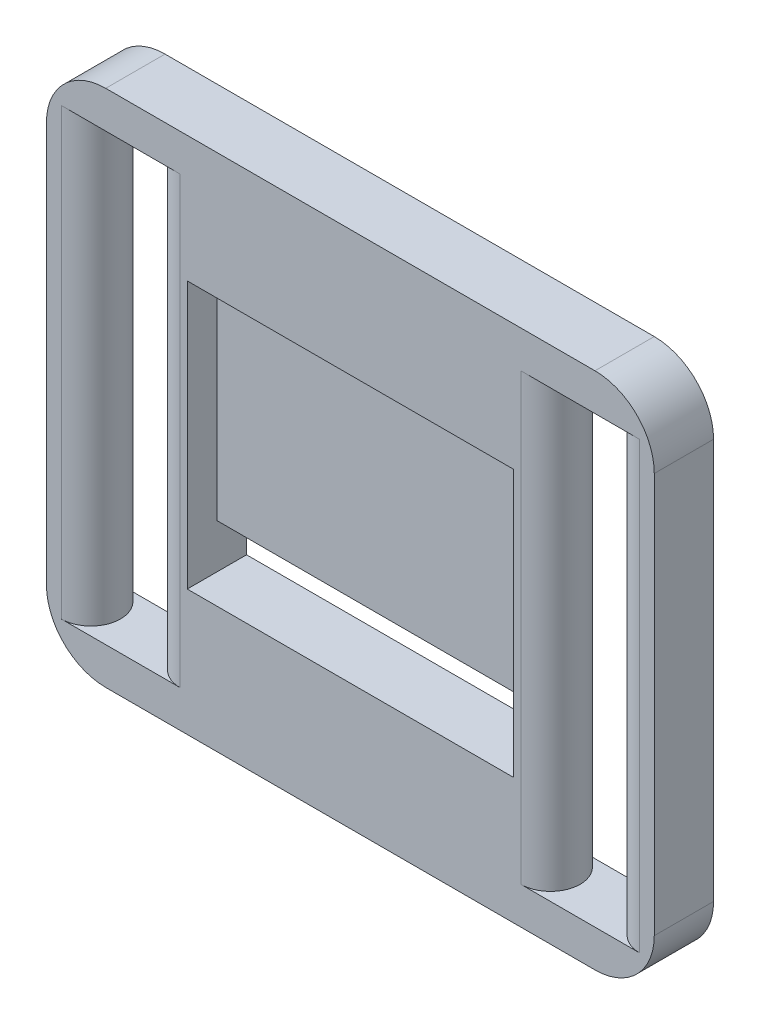
from build123d import *

# Parameters (mm, degrees)
ESQUISSE1_W             = 41
ESQUISSE1_H             = 35
BOSS_EXTRU_1_DEPTH      = 4
ESQUISSE2_W             = 22
ESQUISSE2_H             = 18
ENL_V_MAT_EXTRU_1_DEPTH = 2
ESQUISSE3_W             = 4
ESQUISSE3_H             = 30
ESQUISSE3_W_2           = 22
ESQUISSE3_H_2           = 3
ENL_V_MAT_EXTRU_2_DEPTH = 6
CONG_4_R                = 4
CONG_6_RADIUS           = 2
CONG_6_LENGTH           = 30
CONG_7_RADIUS           = 2
CONG_7_LENGTH           = 30
CONG_8_RADIUS           = 2
CONG_8_LENGTH           = 30
CONG_9_RADIUS           = 2
CONG_9_LENGTH           = 30


with BuildPart() as part:
    # Esquisse1 → Boss.-Extru.1 (new body)
    with BuildSketch(Plane.XY):
        with Locations((20.5, 17.5)):
            Rectangle(ESQUISSE1_W, ESQUISSE1_H)
    extrude(amount=BOSS_EXTRU_1_DEPTH)

    # Esquisse2 → Enlèv. mat.-Extru.1 (cut)
    with BuildSketch(Plane.XY.offset(4)):
        with Locations((20.5, 17.5)):
            Rectangle(ESQUISSE2_W, ESQUISSE2_H)
    extrude(amount=-ENL_V_MAT_EXTRU_1_DEPTH, mode=Mode.SUBTRACT)

    # Esquisse3 → Enlèv. mat.-Extru.2 (cut)
    with BuildSketch(Plane.XY.offset(4)):
        with Locations((5, 17.5)):
            Rectangle(ESQUISSE3_W, ESQUISSE3_H)
        with Locations((36, 17.5)):
            Rectangle(ESQUISSE3_W, ESQUISSE3_H)
        with Locations((20.5, 10)):
            Rectangle(ESQUISSE3_W_2, ESQUISSE3_H_2)
    extrude(amount=-ENL_V_MAT_EXTRU_2_DEPTH, mode=Mode.SUBTRACT)

    # Congé4
    cong_4_edges = [part.edges().sort_by_distance(p)[0] for p in [
        (0, 35, 2),
        (41, 35, 2),
        (41, 0, 2),
        (0, 0, 2),
    ]]
    fillet(cong_4_edges, radius=CONG_4_R)

    # Congé6: full round fillet: the end face becomes a half cylinder, R = half its width
    cong_6_face = Plane((38, 17.5, 2), x_dir=(0, -1, 0), z_dir=(-1, 0, 0))  # on the end face: x along it, z out of the body
    cong_6_slab = cong_6_face.offset(-CONG_6_RADIUS / 2) * Box(CONG_6_LENGTH, 2 * CONG_6_RADIUS, CONG_6_RADIUS, mode=Mode.PRIVATE)  # the body's end, R deep
    cong_6_round = Plane((40, 17.5, 2), x_dir=(-1, 0, 0), z_dir=(0, -1, 0)) * Cylinder(CONG_6_RADIUS, CONG_6_LENGTH, mode=Mode.PRIVATE)  # its axis R under the face
    add(cong_6_slab - cong_6_round, mode=Mode.SUBTRACT)

    # Congé7: full round fillet: the end face becomes a half cylinder, R = half its width
    cong_7_face = Plane((3, 17.5, 2), x_dir=(0, 1, 0), z_dir=(1, 0, 0))  # on the end face: x along it, z out of the body
    cong_7_slab = cong_7_face.offset(-CONG_7_RADIUS / 2) * Box(CONG_7_LENGTH, 2 * CONG_7_RADIUS, CONG_7_RADIUS, mode=Mode.PRIVATE)  # the body's end, R deep
    cong_7_round = Plane((1, 17.5, 2), x_dir=(1, 0, 0), z_dir=(0, 1, 0)) * Cylinder(CONG_7_RADIUS, CONG_7_LENGTH, mode=Mode.PRIVATE)  # its axis R under the face
    add(cong_7_slab - cong_7_round, mode=Mode.SUBTRACT)

    # Congé8: full round fillet: the end face becomes a half cylinder, R = half its width
    cong_8_face = Plane((34, 17.5, 2), x_dir=(0, 1, 0), z_dir=(1, 0, 0))  # on the end face: x along it, z out of the body
    cong_8_slab = cong_8_face.offset(-CONG_8_RADIUS / 2) * Box(CONG_8_LENGTH, 2 * CONG_8_RADIUS, CONG_8_RADIUS, mode=Mode.PRIVATE)  # the body's end, R deep
    cong_8_round = Plane((32, 17.5, 2), x_dir=(1, 0, 0), z_dir=(0, 1, 0)) * Cylinder(CONG_8_RADIUS, CONG_8_LENGTH, mode=Mode.PRIVATE)  # its axis R under the face
    add(cong_8_slab - cong_8_round, mode=Mode.SUBTRACT)

    # Congé9: full round fillet: the end face becomes a half cylinder, R = half its width
    cong_9_face = Plane((7, 17.5, 2), x_dir=(0, -1, 0), z_dir=(-1, 0, 0))  # on the end face: x along it, z out of the body
    cong_9_slab = cong_9_face.offset(-CONG_9_RADIUS / 2) * Box(CONG_9_LENGTH, 2 * CONG_9_RADIUS, CONG_9_RADIUS, mode=Mode.PRIVATE)  # the body's end, R deep
    cong_9_round = Plane((9, 17.5, 2), x_dir=(-1, 0, 0), z_dir=(0, -1, 0)) * Cylinder(CONG_9_RADIUS, CONG_9_LENGTH, mode=Mode.PRIVATE)  # its axis R under the face
    add(cong_9_slab - cong_9_round, mode=Mode.SUBTRACT)


solid = part.part
